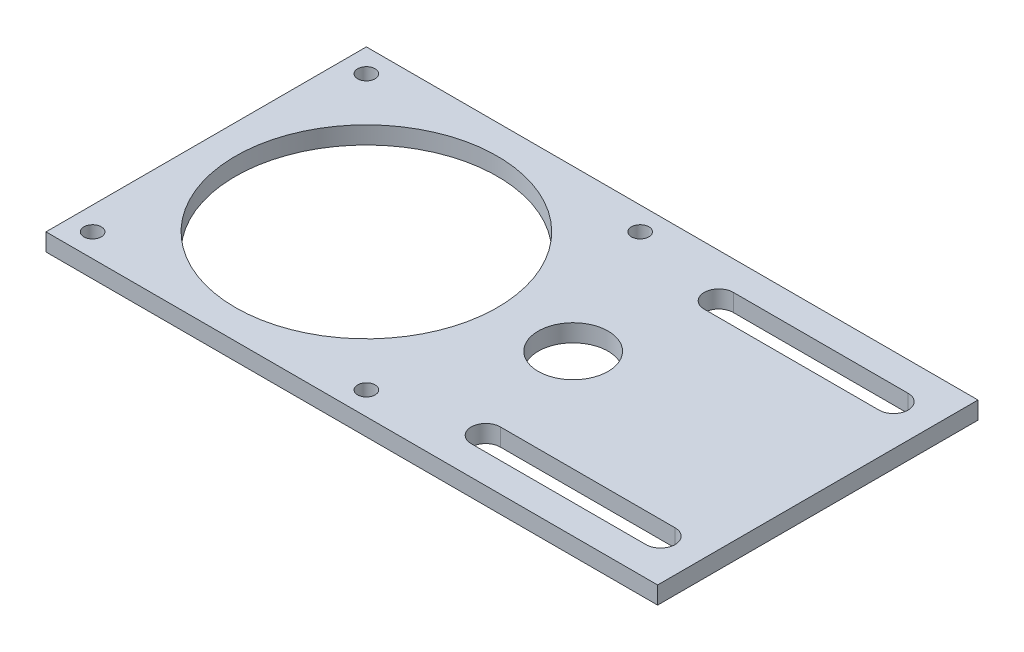
from build123d import *

# Parameters (mm, degrees)
SKETCH1_W           = 105
SKETCH1_H           = 55
SKETCH1_R           = 22.5
SKETCH1_R_2         = 6
SKETCH1_R_3         = 1.5
BOSS_EXTRUDE1_DEPTH = 3


with BuildPart() as part:
    # Sketch1 → Boss-Extrude1 (new body)
    with BuildSketch(Plane(origin=(0, 0, 0), x_dir=(1, 0, 0), z_dir=(0, 1, 0))):
        with Locations((52.5, 27.5)):
            Rectangle(SKETCH1_W, SKETCH1_H)
        with Locations((27.5, 27.5)):
            Circle(SKETCH1_R, mode=Mode.SUBTRACT)
        with Locations((63, 27.5)):
            Circle(SKETCH1_R_2, mode=Mode.SUBTRACT)
        with Locations((4, 4)):
            Circle(SKETCH1_R_3, mode=Mode.SUBTRACT)
        with Locations((51, 4)):
            Circle(SKETCH1_R_3, mode=Mode.SUBTRACT)
        with Locations((51, 51)):
            Circle(SKETCH1_R_3, mode=Mode.SUBTRACT)
        with Locations((4, 51)):
            Circle(SKETCH1_R_3, mode=Mode.SUBTRACT)
        with BuildLine():
            Line((98, 45), (68, 45))
            ThreePointArc((68, 45), (65.5, 47.5), (68, 50))
            Line((68, 50), (98, 50))
            ThreePointArc((98, 50), (100.5, 47.5), (98, 45))
        make_face(mode=Mode.SUBTRACT)
        with BuildLine():
            Line((98, 5), (68, 5))
            ThreePointArc((68, 5), (65.5, 7.5), (68, 10))
            Line((68, 10), (98, 10))
            ThreePointArc((98, 10), (100.5, 7.5), (98, 5))
        make_face(mode=Mode.SUBTRACT)
    extrude(amount=BOSS_EXTRUDE1_DEPTH)


solid = part.part
